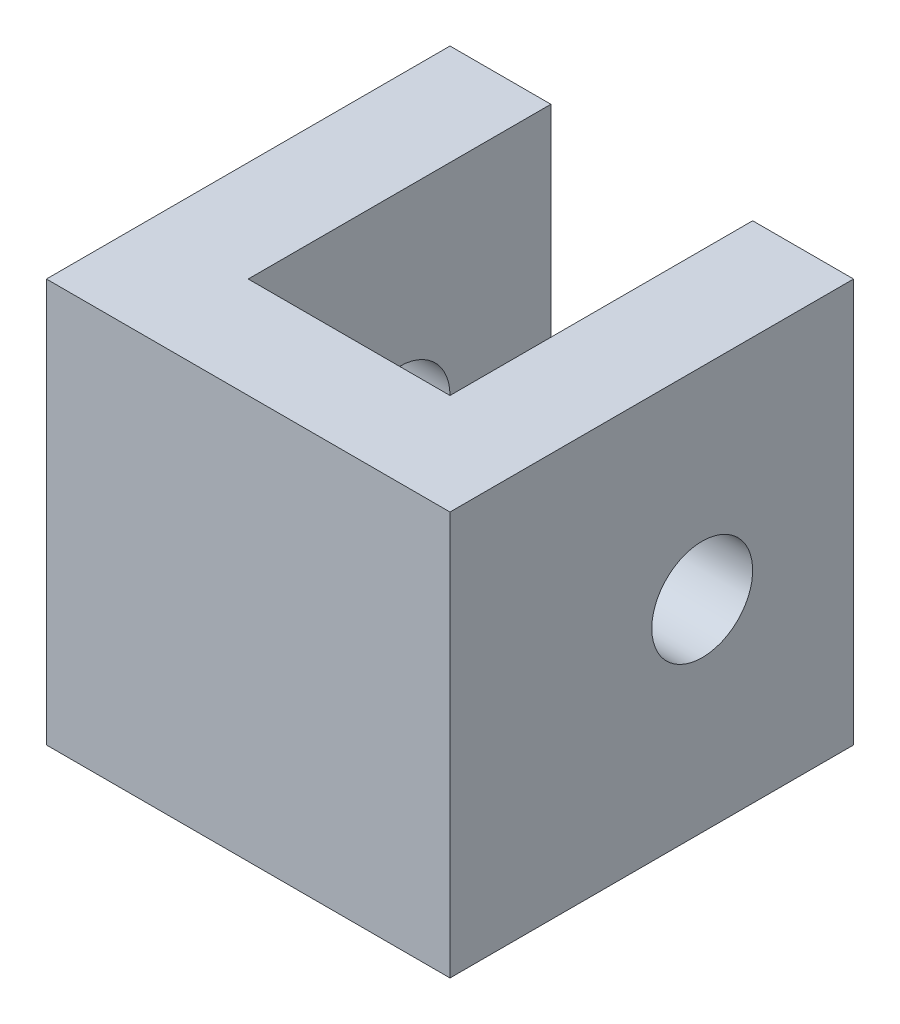
from build123d import *

# Parameters (mm, degrees)
BOSS_EXTRUDE1_DEPTH      = 12.7
BOSS_EXTRUDE1_DEPTH_BACK = 12.7
SKETCH3_R                = 3.175
CUT_EXTRUDE1_DEPTH       = 35.478524438


with BuildPart() as part:
    # Sketch1 → Boss-Extrude1 (new, two sides: drawn at the far end of the back side and taken through both)
    with BuildSketch(Plane(origin=(0, 0, 0), x_dir=(1, 0, 0), z_dir=(0, 1, 0)).offset(-BOSS_EXTRUDE1_DEPTH_BACK)):
        Polygon((-24.645544554, -5.847029703), (0.754455446, -5.847029703), (0.754455446, 19.552970297), (-5.595544554, 19.552970297), (-5.595544554, 0.502970297), (-18.295544554, 0.502970297), (-18.295544554, 19.552970297), (-24.645544554, 19.552970297), align=None)
    extrude(amount=BOSS_EXTRUDE1_DEPTH + BOSS_EXTRUDE1_DEPTH_BACK)

    # Sketch3 → Cut-Extrude1 (cut, through all)
    with BuildSketch(Plane.ZY.offset(24.645544554)):
        with Locations((-10.027970297, 0)):
            Circle(SKETCH3_R)
    extrude(amount=-CUT_EXTRUDE1_DEPTH, mode=Mode.SUBTRACT)


solid = part.part
